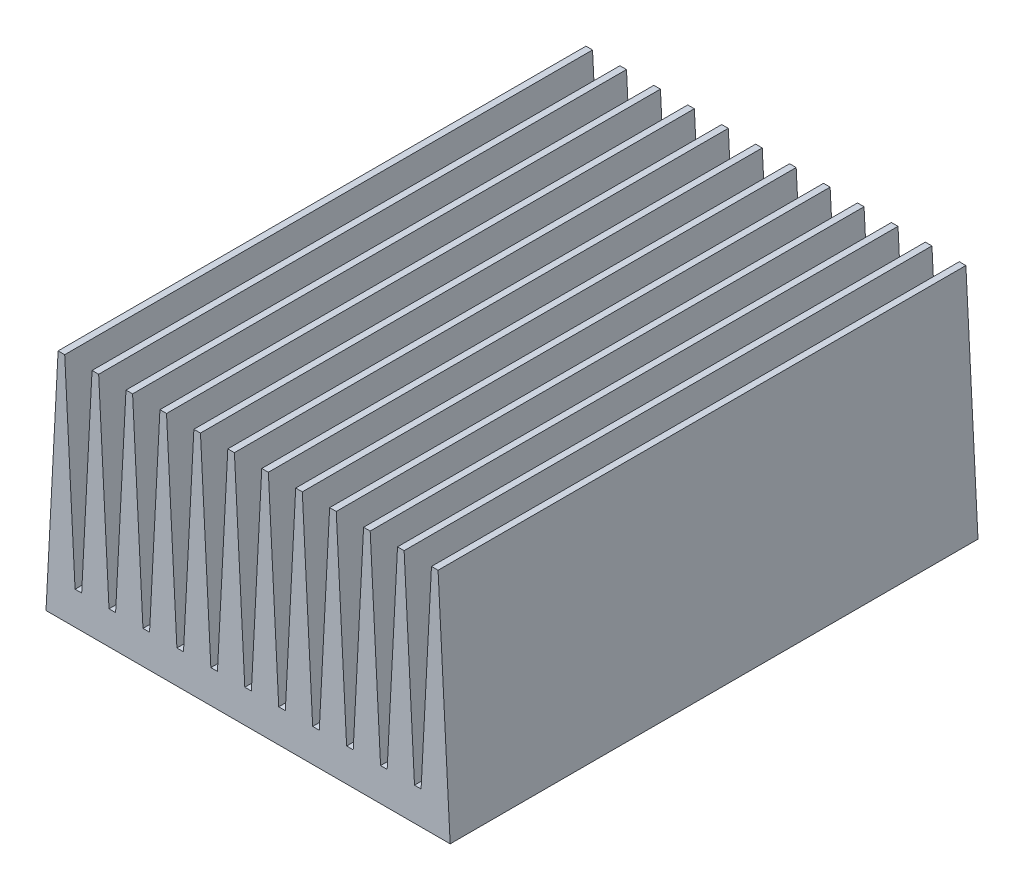
from build123d import *

# Parameters (mm, degrees)
BOSS_EXTRUDE1_DEPTH  = 2032
LPATTERN1_COUNT      = 6
LPATTERN1_PITCH      = 130.66776
LPATTERN1_COUNT_DIR2 = 7
LPATTERN1_PITCH_DIR2 = 130.66776
CUT_EXTRUDE1_DEPTH   = 2032


with BuildPart() as part:
    # Sketch1 → Boss-Extrude1 (new body)
    with BuildSketch(Plane.XY):
        Polygon((0, 0), (12.7, 0), (52.634727814, 762), (78.034727814, 762), (117.969455627, 0), (130.669455627, 0), (130.669455627, -127), (0, -127), align=None)
    boss_extrude1 = extrude(amount=-BOSS_EXTRUDE1_DEPTH)

    # LPattern1: Boss-Extrude1 6 × 7
    with Locations(*[Vector(-1, 0, 0) * (i * LPATTERN1_PITCH) + Vector(1, 0, 0) * (j * LPATTERN1_PITCH_DIR2) for i in range(LPATTERN1_COUNT) for j in range(LPATTERN1_COUNT_DIR2) if (i, j) != (0, 0)]):
        add(boss_extrude1)

    # Sketch2 → Cut-Extrude1 (cut)
    with BuildSketch(Plane.XY):
        Polygon((-640.6388, 0), (-647.294587969, -127), (-653.3388, -127), (-653.3388, 0), align=None)
        Polygon((901.976015627, 0), (908.631803596, -127), (914.676015627, -127), (914.676015627, 0), align=None)
    extrude(amount=-CUT_EXTRUDE1_DEPTH, mode=Mode.SUBTRACT)


solid = part.part
